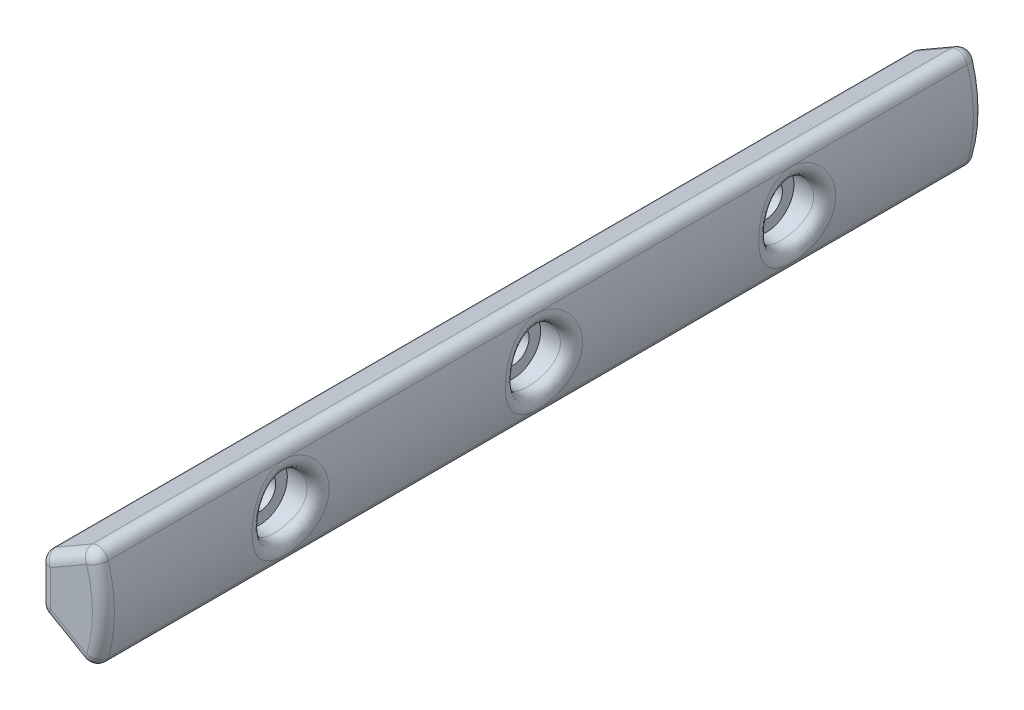
from build123d import *

# Parameters (mm, degrees)
BOSS_EXTRUDE1_DEPTH      = 40
BOSS_EXTRUDE1_DEPTH_BACK = 40
SKETCH2_R                = 1.45
CUT_EXTRUDE1_DEPTH       = 41.726404212
CORTAR_EXTRUIR2_START    = 3
CROQUIS3_R               = 2.5
CORTAR_EXTRUIR2_DEPTH    = 3
REDONDEO1_R              = 1


with BuildPart() as part:
    # Sketch1 → Boss-Extrude1 (new, two sides: drawn at the far end of the back side and taken through both)
    with BuildSketch(Plane.XY.offset(-BOSS_EXTRUDE1_DEPTH_BACK)):
        with BuildLine():
            Line((2.886751346, 5), (-1.953184858, 2.20566153))
            Line((-1.953184858, 2.20566153), (-1.953184858, -2.20566153))
            Line((-1.953184858, -2.20566153), (2.886751346, -5))
            ThreePointArc((2.886751346, -5), (3.846815142, 0), (2.886751346, 5))
        make_face()
    extrude(amount=BOSS_EXTRUDE1_DEPTH + BOSS_EXTRUDE1_DEPTH_BACK)

    # Sketch2 → Cut-Extrude1 (cut, through all)
    with BuildSketch(Plane.ZY.offset(1.953184858)):
        Circle(SKETCH2_R)
        with Locations((-23, 0)):
            Circle(SKETCH2_R)
        with Locations((23, 0)):
            Circle(SKETCH2_R)
    extrude(amount=-CUT_EXTRUDE1_DEPTH, mode=Mode.SUBTRACT)

    # Croquis3 → Cortar-Extruir2 (cut)
    with BuildSketch(Plane(origin=(-1.953184858, 0, 0), x_dir=(0, 0, -1), z_dir=(1, 0, 0)).offset(CORTAR_EXTRUIR2_START)):
        with Locations((-23, 0)):
            Circle(CROQUIS3_R)
        Circle(CROQUIS3_R)
        with Locations((23, 0)):
            Circle(CROQUIS3_R)
    extrude(amount=CORTAR_EXTRUIR2_DEPTH, mode=Mode.SUBTRACT)

    # Redondeo1
    redondeo1_edges = [part.edges().sort_by_distance(p)[0] for p in [
        (3.846815142, 0, -40),
        (0.466783244, 3.602830765, -40),
        (-1.953184858, 0, -40),
        (0.466783244, -3.602830765, -40),
        (-1.953184858, 0, 40),
        (0.466783244, 3.602830765, 40),
        (3.846815142, 0, 40),
        (0.466783244, -3.602830765, 40),
        (3.846815141, 1e-09, -20.499999982),
        (3.846815141, 1e-09, 2.500000018),
        (3.846815141, 1e-09, 25.500000018),
        (-1.953184858, 2.20566153, 0),
        (-1.953184858, -2.20566153, 0),
        (2.886751346, -5, 0),
        (2.886751346, 5, 0),
    ]]
    fillet(redondeo1_edges, radius=REDONDEO1_R)


solid = part.part
